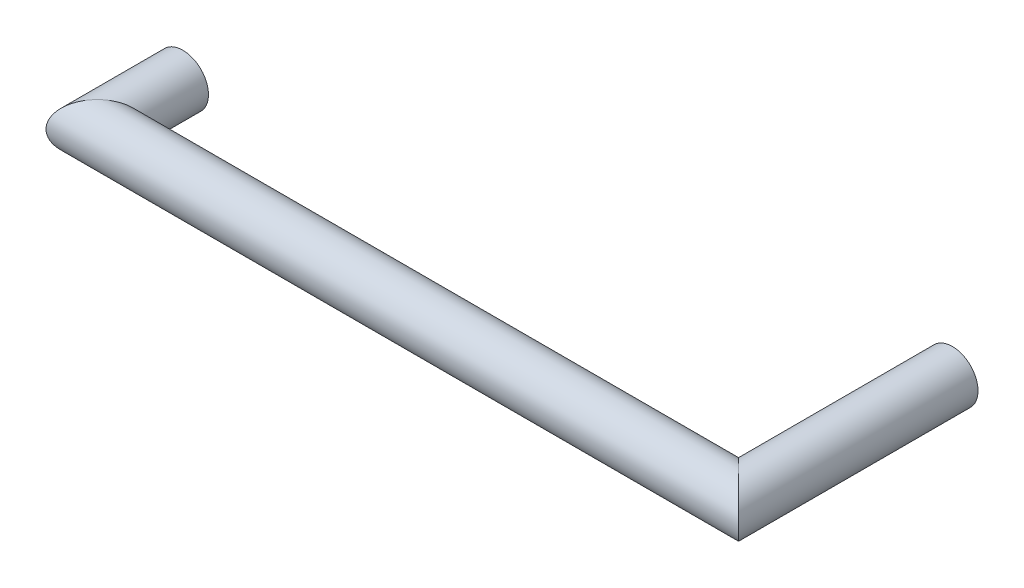
from build123d import *

# Parameters (mm, degrees)
SKETCH3_R = 0.6


with BuildPart() as part:
    # Sweep1: sweep along a path in Sketch2
    with BuildLine(Plane(origin=(0, 0, 0), x_dir=(1, 0, 0), z_dir=(0, 1, 0))) as sweep1_path:
        Line((-7.5, 2), (-7.5, 0))
        Line((-7.5, 0), (7.5, 0))
        Line((7.5, 0), (7.5, 5))
    # Sketch3 → Sweep1 (sweep)
    with BuildSketch(Plane(origin=(-7.5, 0, -2), x_dir=(-1, 0, 0), z_dir=(0, 0, -1))):
        Circle(SKETCH3_R)
    sweep(path=sweep1_path.line, transition=Transition.RIGHT)


solid = part.part
